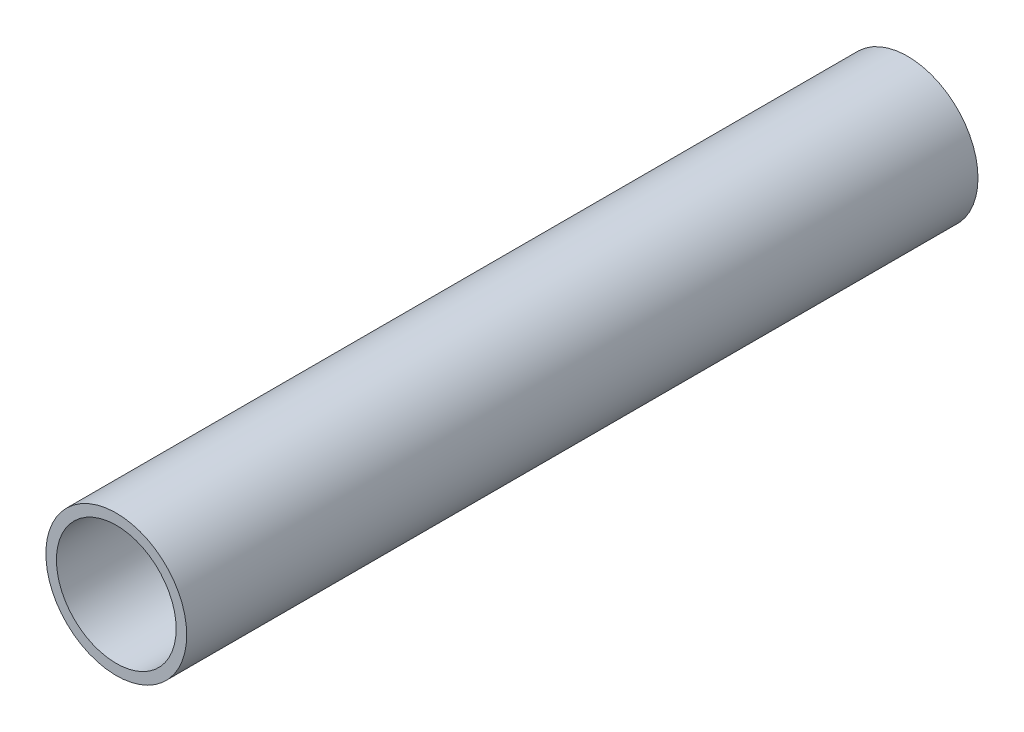
from build123d import *

# Parameters (mm, degrees)
SKETCH1_R           = 13.35
SKETCH1_R_2         = 11.35
EXTRUDE_THIN1_DEPTH = 75


with BuildPart() as part:
    # Sketch1 → Extrude-Thin1 (new, symmetric)
    with BuildSketch(Plane.XY):
        Circle(SKETCH1_R)
        Circle(SKETCH1_R_2, mode=Mode.SUBTRACT)
    extrude(amount=EXTRUDE_THIN1_DEPTH, both=True)


solid = part.part
